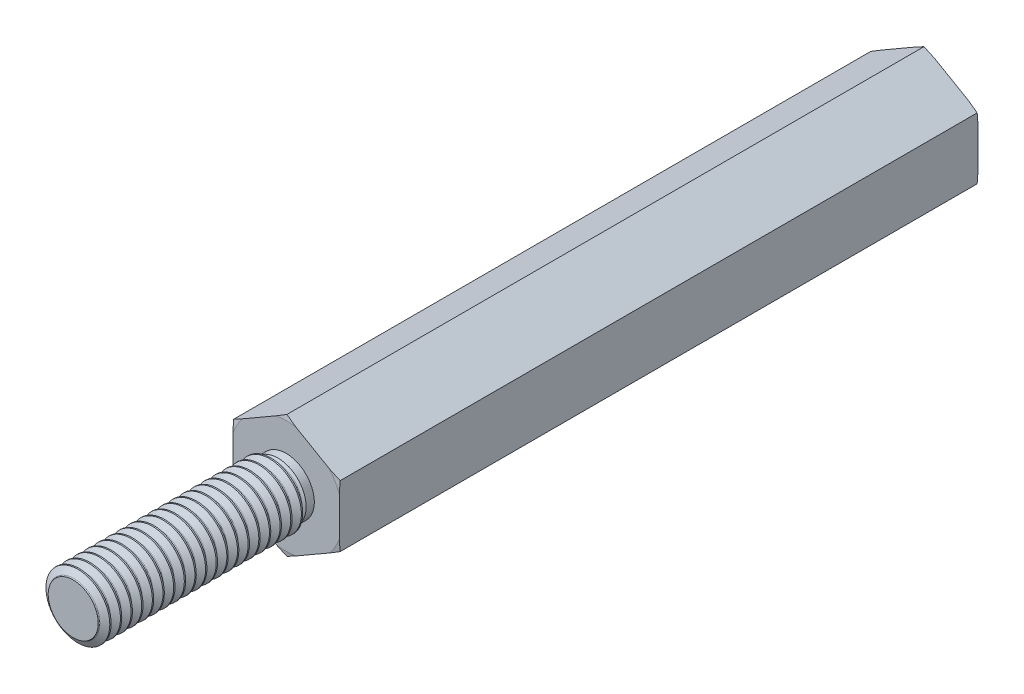
from build123d import *

# Parameters (mm, degrees)
SKETCH5_W            = 30
SKETCH5_H            = 2.886751346
SKETCH11_OUTSIDE_W   = 13.992
SKETCH11_OUTSIDE_H   = 13.992
CUT_PROFILE_DEPTH    = 31.276503541
PATTERN_THREAD_COUNT = 20
PATTERN_THREAD_PITCH = 0.5


with BuildPart() as part:
    # Sketch5 → body (revolve)
    with BuildSketch(Plane(origin=(0, 0, 0), x_dir=(0, 0, -1), z_dir=(1, 0, 0)), mode=Mode.PRIVATE) as body_sk:
        with Locations((-15, 1.443375673)):
            Rectangle(SKETCH5_W, SKETCH5_H)
    revolve(body_sk.sketch.rotate(Axis((0, 0, 255.103275), (0, 0, -1)), 90), axis=Axis((0, 0, 255.103275), (0, 0, -1)))

    # Sketch11 outside → cut-profile (cut, through all)
    with BuildSketch(Plane.XY):
        Rectangle(SKETCH11_OUTSIDE_W, SKETCH11_OUTSIDE_H)
        Polygon((2.5, -1.443375673), (2.5, 1.443375673), (0, 2.886751346), (-2.5, 1.443375673), (-2.5, -1.443375673), (0, -2.886751346), align=None, mode=Mode.SUBTRACT)
    extrude(amount=CUT_PROFILE_DEPTH, mode=Mode.SUBTRACT)

    # Sketch13 → cosmetic-cuts (revolve, cut)
    with BuildSketch(Plane(origin=(0, 0, 0), x_dir=(0, 0, -1), z_dir=(1, 0, 0))):
        Polygon((-30, 2.662707144), (-29.960494962, 2.886751346), (-30, 2.886751346), align=None)
        Polygon((0, 2.886751346), (-0.039505038, 2.886751346), (0, 2.662707144), align=None)
    revolve(axis=Axis((0, 0, 255.103275), (0, 0, -1)), mode=Mode.SUBTRACT)

    # Sketch6 → cut-front-hole (revolve, cut)
    with BuildSketch(Plane(origin=(0, 0, 0), x_dir=(0, 0, -1), z_dir=(1, 0, 0)), mode=Mode.PRIVATE) as cut_front_hole_sk:
        Polygon((0, 0), (-10.545955351, 0), (-10, 1.5), (0, 1.5), align=None)
    revolve(cut_front_hole_sk.sketch.rotate(Axis((0, 0, 255.103275), (0, 0, -1)), 270), axis=Axis((0, 0, 255.103275), (0, 0, -1)), mode=Mode.SUBTRACT)

    # Sketch8 → cut-front-chamfer (revolve, cut)
    with BuildSketch(Plane(origin=(0, 0, 0), x_dir=(0, 0, -1), z_dir=(1, 0, 0)), mode=Mode.PRIVATE) as cut_front_chamfer_sk:
        Polygon((0, 1.764490471), (0, 1.5), (-0.264490471, 1.5), align=None)
    revolve(cut_front_chamfer_sk.sketch.rotate(Axis((0, 0, 255.103275), (0, 0, -1)), 90), axis=Axis((0, 0, 255.103275), (0, 0, -1)), mode=Mode.SUBTRACT)

    # Sketch20 → body-shaft (revolve)
    with BuildSketch(Plane(origin=(0, 0, 0), x_dir=(0, 0, -1), z_dir=(1, 0, 0)), mode=Mode.PRIVATE) as body_shaft_sk:
        Polygon((-30, 1.324533332), (-30, 0), (-40, 0), (-40, 1.5), (-30.482090707, 1.5), (-30.482090707, 1.324533332), align=None)
    revolve(body_shaft_sk.sketch.rotate(Axis((0, 0, 255.103275), (0, 0, -1)), 90), axis=Axis((0, 0, 255.103275), (0, 0, -1)))

    # Sketch21 → cut-thread-simple (revolve, cut)
    with BuildSketch(Plane(origin=(0, 0, 0), x_dir=(0, 0, -1), z_dir=(1, 0, 0)), mode=Mode.PRIVATE) as cut_thread_simple_sk:
        with BuildLine():
            Line((-39.953125, -1.202303767), (-39.78125, -1.5))
            Line((-39.78125, -1.5), (-40.21875, -1.5))
            Line((-40.21875, -1.5), (-40.046875, -1.202303767))
            ThreePointArc((-40.046875, -1.202303767), (-40, -1.175240474), (-39.953125, -1.202303767))
        make_face()
    cut_thread_simple = revolve(cut_thread_simple_sk.sketch.rotate(Axis((0, 0, 255.103275), (0, 0, -1)), 270), axis=Axis((0, 0, 255.103275), (0, 0, -1)), mode=Mode.SUBTRACT)

    # pattern-thread: cut-thread-simple ×20
    with Locations(*[(0, 0, -i * PATTERN_THREAD_PITCH) for i in range(1, PATTERN_THREAD_COUNT)]):
        add(cut_thread_simple, mode=Mode.SUBTRACT)


solid = part.part
